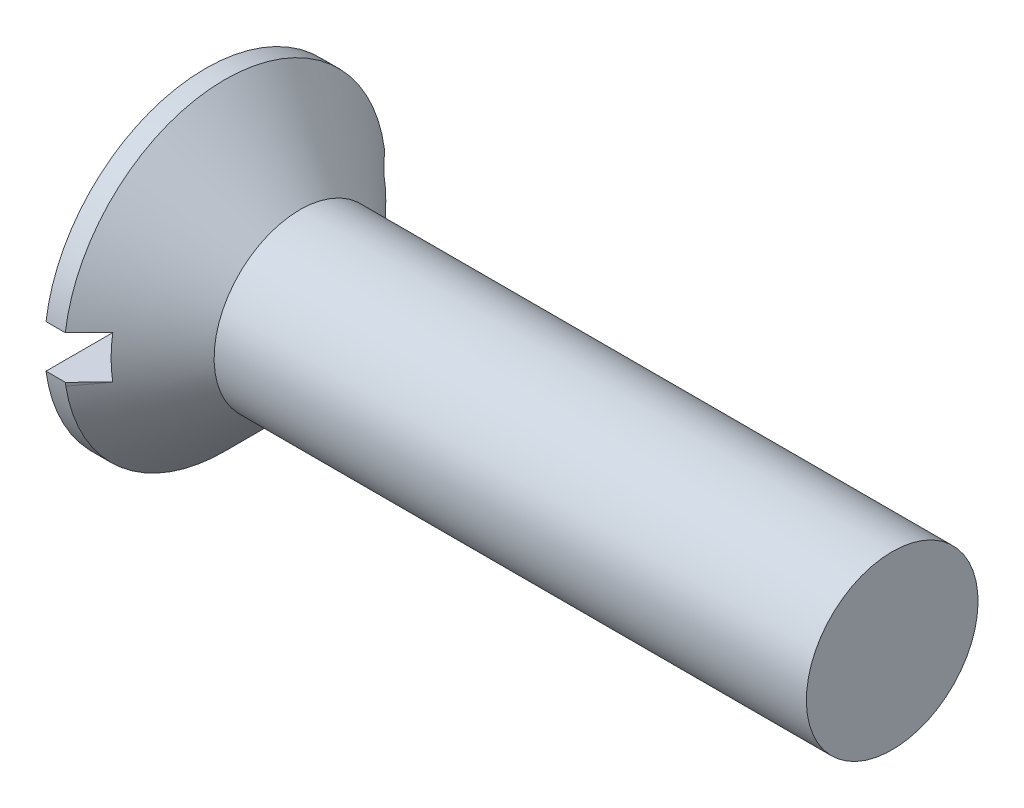
from build123d import *

# Parameters (mm, degrees)
SKETCH2_W          = 7.5
SKETCH2_H          = 1
CUT_EXTRUDE1_DEPTH = 1


with BuildPart() as part:
    # Sketch1 → Revolve1 (revolve)
    with BuildSketch(Plane.XY):
        Polygon((0, 0), (0, 3.75), (0.45, 3.75), (2.2, 2), (16, 2), (16, 0), align=None)
    revolve(axis=Axis((16, 0, 0), (-1, 0, 0)))

    # Sketch2 → Cut-Extrude1 (cut)
    with BuildSketch(Plane.ZY):
        Rectangle(SKETCH2_W, SKETCH2_H)
    extrude(amount=-CUT_EXTRUDE1_DEPTH, mode=Mode.SUBTRACT)


solid = part.part
